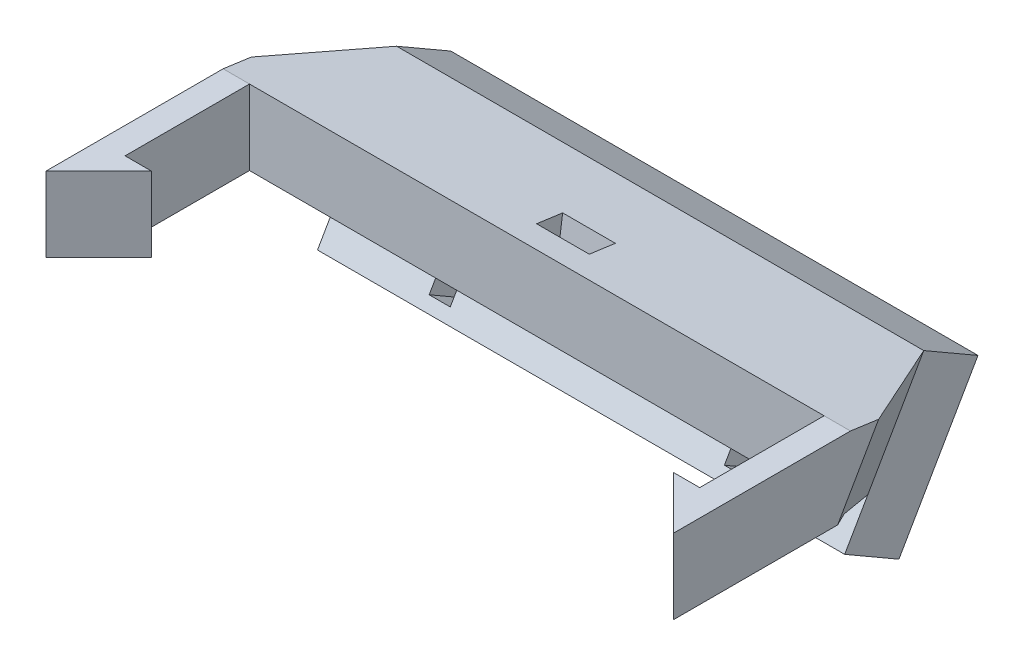
from build123d import *

# Parameters (mm, degrees)
SKETCH1_W                      = 75.565
SKETCH1_H                      = 35.56
BOSS_EXTRUDE1_DEPTH            = 3.175
SKETCH6_W                      = 3.175
SKETCH6_H                      = 9.028368652
BOSS_EXTRUDE4_DEPTH            = 14.986
BOSS_EXTRUDE6_DEPTH            = 9.028368652
BOSS_EXTRUDE7_DEPTH            = 75.565
SKETCH10_W                     = 75.565
SKETCH10_H                     = 23.368
BOSS_EXTRUDE8_DEPTH            = 7.545165067
CUT_EXTRUDE1_DEPTH             = 82.438667238
CUT_EXTRUDE2_REACH             = 52.836
SKETCH12_W                     = 6.35
SKETCH12_H                     = 3.175
CUT_EXTRUDE2_DIRECTION_2_DEPTH = 51.836411552
CUT_EXTRUDE3_DEPTH             = 55.765947786
CUT_EXTRUDE4_REACH             = 57.378
SKETCH14_W                     = 2.54
SKETCH14_H                     = 3.81
CUT_EXTRUDE5_REACH             = 57.378
SKETCH15_W                     = 114.661215645
SKETCH15_H                     = 6.578342779


with BuildPart() as part:
    # Sketch1 → Boss-Extrude1 (new body)
    with BuildSketch(Plane.XY):
        Rectangle(SKETCH1_W, SKETCH1_H)
    extrude(amount=-BOSS_EXTRUDE1_DEPTH)

    # Sketch6 → Boss-Extrude4 (add)
    with BuildSketch(Plane.XY):
        with Locations((-36.195, 0)):
            Rectangle(SKETCH6_W, SKETCH6_H)
        with Locations((36.195, 0)):
            Rectangle(SKETCH6_W, SKETCH6_H)
    extrude(amount=BOSS_EXTRUDE4_DEPTH)

    # Sketch8 → Boss-Extrude6 (add)
    with BuildSketch(Plane.XZ.offset(4.514184326)):
        Polygon((-37.7825, 14.986), (-31.4325, 14.986), (-37.7825, 21.336), align=None)
        Polygon((37.7825, 14.986), (31.4325, 14.986), (37.7825, 21.336), align=None)
    extrude(amount=-BOSS_EXTRUDE6_DEPTH)

    # Sketch9 → Boss-Extrude7 (add)
    with BuildSketch(Plane.ZY.offset(37.7825)):
        Polygon((-3.175, 17.78), (-18.572931679, 8.89), (-3.175, -17.78), align=None)
    extrude(amount=-BOSS_EXTRUDE7_DEPTH)

    # Sketch10 → Boss-Extrude8 (add)
    with BuildSketch(Plane(origin=(0, -5.819815329, -10.08021584), x_dir=(-1, 0, 0), z_dir=(0, -0.5000000000000012, -0.8660254037844378))):
        with Locations((0, -2.126431679)):
            Rectangle(SKETCH10_W, SKETCH10_H)
    extrude(amount=BOSS_EXTRUDE8_DEPTH)

    # Sketch11 → Cut-Extrude1 (cut, through all)
    with BuildSketch(Plane.ZY.offset(37.7825)):
        Polygon((-14.859, 2.457281636), (0, 4.514184326), (36.888684706, 18.275511072), (5.286071508, 25.150339228), (-30.3838484, 8.233222823), align=None)
        Polygon((-3.175, -17.78), (-8.125516688, -9.205453573), (0, -4.514184326), (40.158547499, -20.406390647), (15.599703883, -25.394905756), align=None)
    extrude(amount=-CUT_EXTRUDE1_DEPTH, mode=Mode.SUBTRACT)

    # Cut-Extrude2: up to this plane
    cut_extrude2_end = Plane(origin=(37.7825, -9.205453573, -8.125516688), z_dir=(0, 0.8660254037844387, -0.5))
    # Sketch12 → Cut-Extrude2 (cut, up to the surface)
    with BuildSketch(Plane(origin=(0, 4.429308453, -0.61314062), x_dir=(1, 0, 0), z_dir=(0, 0.9905543702216955, -0.13712052958875431)), mode=Mode.PRIVATE) as cut_extrude2_sk1:
        with Locations((0, 4.143512655)):
            Rectangle(SKETCH12_W, SKETCH12_H)
    cut_extrude2_tool1 = split(extrude(cut_extrude2_sk1.sketch, amount=-CUT_EXTRUDE2_REACH, mode=Mode.PRIVATE), bisect_by=cut_extrude2_end, keep=Keep.BOTH, mode=Mode.PRIVATE)
    add(cut_extrude2_tool1.solids().sort_by_distance((0, 3.861148, -4.717515))[0], mode=Mode.SUBTRACT)

    # Sketch12 → Cut-Extrude2 direction 2 (cut)
    with BuildSketch(Plane(origin=(0, 4.429308453, -0.61314062), x_dir=(1, 0, 0), z_dir=(0, 0.9905543702216955, -0.13712052958875431))):
        with Locations((0, 4.143512655)):
            Rectangle(SKETCH12_W, SKETCH12_H)
    extrude(amount=CUT_EXTRUDE2_DIRECTION_2_DEPTH, mode=Mode.SUBTRACT)

    # Sketch13 → Cut-Extrude3 (cut, through all)
    with BuildSketch(Plane(origin=(0, 8.277096964, -4.77878416), x_dir=(1, 0, 0), z_dir=(0, 0.8660254037844379, -0.5000000000000012))):
        Polygon((-31.75, 11.639630657), (-37.7825, 0.917907837), (-37.7825, 11.639630657), (-37.7825, 19.184795724), (-31.75, 19.184795724), align=None)
        Polygon((37.7825, 0.917907837), (37.7825, 11.639630657), (37.7825, 19.184795724), (31.75, 19.184795724), (31.75, 11.639630657), align=None)
    extrude(amount=-CUT_EXTRUDE3_DEPTH, mode=Mode.SUBTRACT)

    # Sketch14 → Cut-Extrude4 (cut, up to next)
    with BuildSketch(Plane(origin=(0, -9.592397862, -16.614520463), x_dir=(-1, 0, 0), z_dir=(0, -0.5000000000000013, -0.8660254037844379)), mode=Mode.PRIVATE) as cut_extrude4_sk1:
        with Locations((-17.78, -6.082892111)):
            Rectangle(SKETCH14_W, SKETCH14_H)
    cut_extrude4_tool1 = extrude(cut_extrude4_sk1.sketch, amount=-CUT_EXTRUDE4_REACH, mode=Mode.PRIVATE) & part.part
    # Sketch14 → Cut-Extrude4 (cut, up to next)
    with BuildSketch(Plane(origin=(0, -9.592397862, -16.614520463), x_dir=(-1, 0, 0), z_dir=(0, -0.5000000000000013, -0.8660254037844379)), mode=Mode.PRIVATE) as cut_extrude4_sk2:
        with Locations((17.78, -6.082892111)):
            Rectangle(SKETCH14_W, SKETCH14_H)
    cut_extrude4_tool2 = extrude(cut_extrude4_sk2.sketch, amount=-CUT_EXTRUDE4_REACH, mode=Mode.PRIVATE) & part.part
    add(cut_extrude4_tool1.solids().sort_by_distance((17.78, -14.860337, -13.573074))[0], mode=Mode.SUBTRACT)
    add(cut_extrude4_tool2.solids().sort_by_distance((-17.78, -14.860337, -13.573074))[0], mode=Mode.SUBTRACT)

    # Sketch15 → Cut-Extrude5 (cut, up to next)
    with BuildSketch(Plane(origin=(0, -9.592397862, -16.614520463), x_dir=(-1, 0, 0), z_dir=(0, -0.5000000000000012, -0.8660254037844378)), mode=Mode.PRIVATE) as cut_extrude5_sk1:
        with Locations((-7.679066914, -12.781603069)):
            Rectangle(SKETCH15_W, SKETCH15_H)
    cut_extrude5_tool1 = extrude(cut_extrude5_sk1.sketch, amount=-CUT_EXTRUDE5_REACH, mode=Mode.PRIVATE) & part.part
    add(cut_extrude5_tool1.solids().sort_by_distance((7.679067, -20.661591, -10.223719))[0], mode=Mode.SUBTRACT)


solid = part.part
